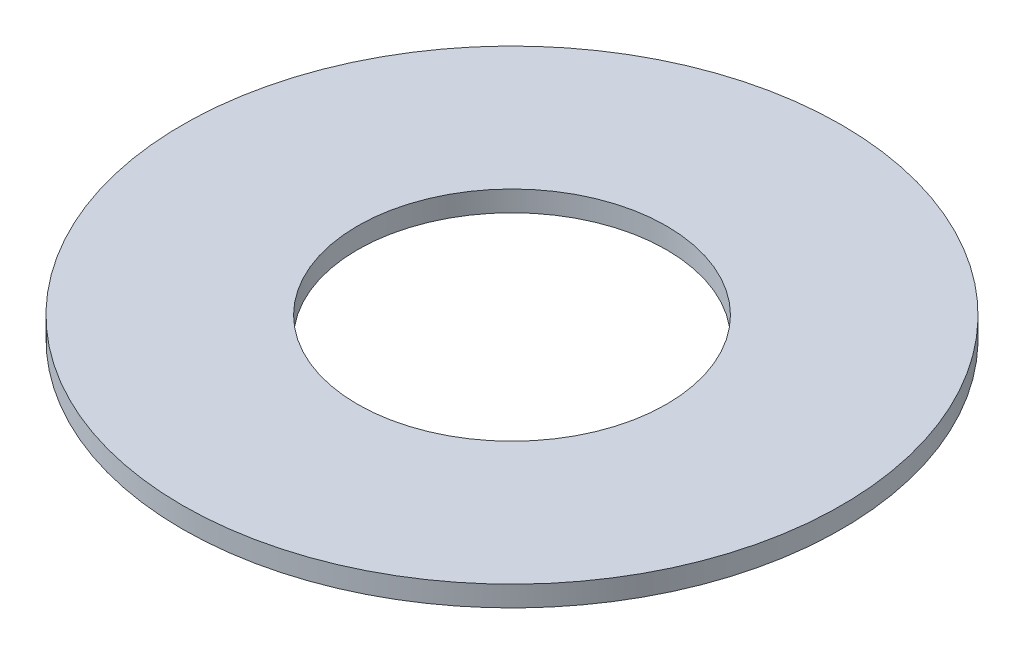
from build123d import *

# Parameters (mm, degrees)
SZKIC1_R                    = 16
SZKIC1_R_2                  = 7.5
DODANIE_WYCI_GNI_CIE1_DEPTH = 1


with BuildPart() as part:
    # Szkic1 → Dodanie-wyciągnięcie1 (new body)
    with BuildSketch(Plane(origin=(0, 0, 0), x_dir=(1, 0, 0), z_dir=(0, 1, 0))):
        with Locations(Location((0, 0, 0), (0, 0, 270))):
            Circle(SZKIC1_R)
        with Locations(Location((0, 0, 0), (0, 0, 270))):
            Circle(SZKIC1_R_2, mode=Mode.SUBTRACT)
    extrude(amount=DODANIE_WYCI_GNI_CIE1_DEPTH)


solid = part.part
